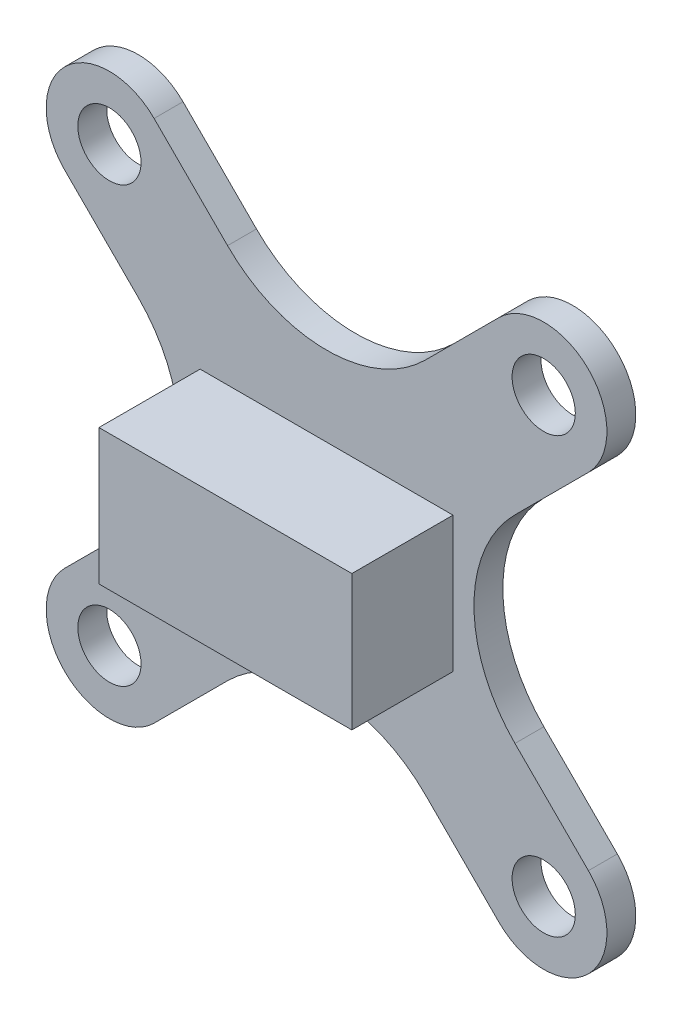
from build123d import *

# Parameters (mm, degrees)
SKETCH1_R           = 1.75
SKETCH1_W           = 5
SKETCH1_H           = 4
BOSS_EXTRUDE1_DEPTH = 1.6
SKETCH1_3_W         = 14
SKETCH1_3_H         = 7.5
BOSS_EXTRUDE2_DEPTH = 7.2
SKETCH1_5_W         = 5
SKETCH1_5_H         = 4
BOSS_EXTRUDE3_DEPTH = 1.7


with BuildPart() as part:
    # Sketch1 → Boss-Extrude1 (new body)
    with BuildSketch(Plane.XY):
        with BuildLine():
            Line((-14.495689014, 9.545941546), (-10.429825023, 5.480077554))
            ThreePointArc((-10.429825023, 5.480077554), (-8.159902577, 0), (-10.429825023, -5.480077554))
            Line((-10.429825023, -5.480077554), (-14.495689014, -9.545941546))
            ThreePointArc((-14.495689014, -9.545941546), (-14.495689014, -14.495689014), (-9.545941546, -14.495689014))
            Line((-9.545941546, -14.495689014), (-5.480077554, -10.429825023))
            ThreePointArc((-5.480077554, -10.429825023), (0, -8.159902577), (5.480077554, -10.429825023))
            Line((5.480077554, -10.429825023), (9.545941546, -14.495689014))
            ThreePointArc((9.545941546, -14.495689014), (14.495689014, -14.495689014), (14.495689014, -9.545941546))
            Line((14.495689014, -9.545941546), (10.429825023, -5.480077554))
            ThreePointArc((10.429825023, -5.480077554), (8.159902577, 0), (10.429825023, 5.480077554))
            Line((10.429825023, 5.480077554), (14.495689014, 9.545941546))
            ThreePointArc((14.495689014, 9.545941546), (14.495689014, 14.495689014), (9.545941546, 14.495689014))
            Line((9.545941546, 14.495689014), (5.480077554, 10.429825023))
            ThreePointArc((5.480077554, 10.429825023), (0, 8.159902577), (-5.480077554, 10.429825023))
            Line((-5.480077554, 10.429825023), (-9.545941546, 14.495689014))
            ThreePointArc((-9.545941546, 14.495689014), (-14.495689014, 14.495689014), (-14.495689014, 9.545941546))
        make_face()
        with Locations((-12.02081528, -12.02081528)):
            Circle(SKETCH1_R, mode=Mode.SUBTRACT)
        with Locations((12.02081528, -12.02081528)):
            Circle(SKETCH1_R, mode=Mode.SUBTRACT)
        with Locations((-12.02081528, 12.02081528)):
            Circle(SKETCH1_R, mode=Mode.SUBTRACT)
        with Locations((12.02081528, 12.02081528)):
            Circle(SKETCH1_R, mode=Mode.SUBTRACT)
        Rectangle(SKETCH1_W, SKETCH1_H, mode=Mode.SUBTRACT)
    extrude(amount=BOSS_EXTRUDE1_DEPTH)

    # Sketch1<3> → Boss-Extrude2 (add)
    with BuildSketch(Plane.XY):
        Rectangle(SKETCH1_3_W, SKETCH1_3_H)
    extrude(amount=BOSS_EXTRUDE2_DEPTH)

    # Sketch1<5> → Boss-Extrude3 (add)
    with BuildSketch(Plane.XY):
        Rectangle(SKETCH1_5_W, SKETCH1_5_H)
    extrude(amount=-BOSS_EXTRUDE3_DEPTH)


solid = part.part
